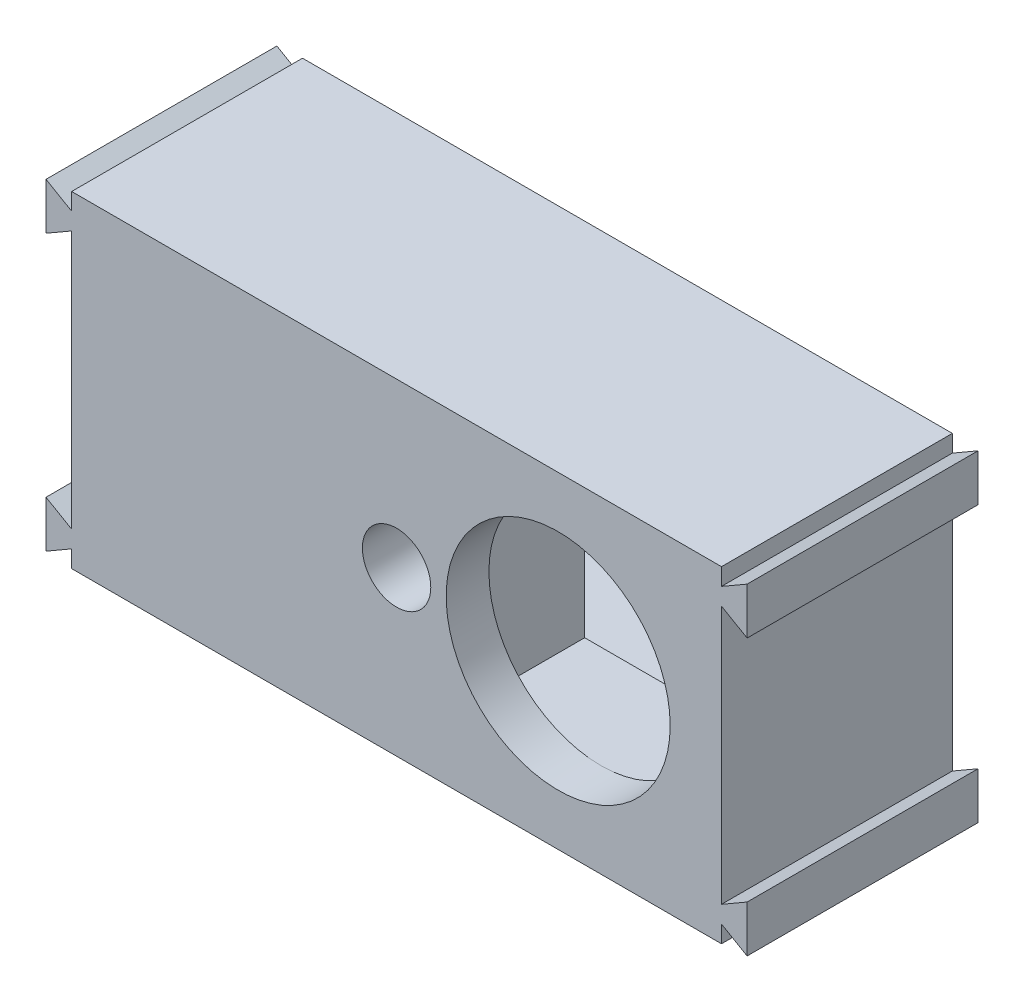
from build123d import *

# Parameters (mm, degrees)
SKETCH2_W           = 38
SKETCH2_H           = 19.1
SKETCH2_R           = 6.55
SKETCH2_R_2         = 2
BOSS_EXTRUDE1_DEPTH = 2.5
SKETCH3_R           = 2
SKETCH3_W           = 13.5
SKETCH3_H           = 13.1
BOSS_EXTRUDE2_DEPTH = 6
BOSS_EXTRUDE3_DEPTH = 5
BOSS_EXTRUDE4_DEPTH = 13.5


with BuildPart() as part:
    # Sketch2 → Boss-Extrude1 (new body)
    with BuildSketch(Plane.XY):
        Rectangle(SKETCH2_W, SKETCH2_H)
        with Locations((9.45, 0)):
            Circle(SKETCH2_R, mode=Mode.SUBTRACT)
        Circle(SKETCH2_R_2, mode=Mode.SUBTRACT)
    extrude(amount=-BOSS_EXTRUDE1_DEPTH)

    # Sketch3 → Boss-Extrude2 (add)
    with BuildSketch(Plane(origin=(0, 0, -2.5), x_dir=(-1, 0, 0), z_dir=(0, 0, -1))):
        Polygon((-19, -9.55), (19, -9.55), (19, -5.55), (2.5, -5.55), (2.5, 5.55), (19, 5.55), (19, 9.55), (-19, 9.55), align=None)
        with Locations(Location((0, 0, 0), (0, 0, 180))):
            Circle(SKETCH3_R, mode=Mode.SUBTRACT)
        with Locations((-9.25, 0)):
            Rectangle(SKETCH3_W, SKETCH3_H, mode=Mode.SUBTRACT)
    extrude(amount=BOSS_EXTRUDE2_DEPTH)

    # Sketch4 → Boss-Extrude3 (add)
    with BuildSketch(Plane(origin=(0, 0, -8.5), x_dir=(-1, 0, 0), z_dir=(0, 0, -1))):
        Polygon((19, 5.55), (16.5, 5.55), (16.5, 7.05), (-16.5, 7.05), (-16.5, -7.05), (16.5, -7.05), (16.5, -5.55), (19, -5.55), (19, -9.55), (-19, -9.55), (-19, 9.55), (19, 9.55), align=None)
    extrude(amount=BOSS_EXTRUDE3_DEPTH)

    # Sketch5 → Boss-Extrude4 (add)
    with BuildSketch(Plane(origin=(0, 0, -13.5), x_dir=(-1, 0, 0), z_dir=(0, 0, -1))):
        Polygon((-19, 8.55), (-20.5, 9.416025404), (-20.5, 6.683974596), (-19, 7.55), align=None)
        Polygon((-19, -7.55), (-19, -8.55), (-20.5, -9.416025404), (-20.5, -6.683974596), align=None)
    boss_extrude4 = extrude(amount=-BOSS_EXTRUDE4_DEPTH)

    # Mirror1: Boss-Extrude4 across plane
    add(boss_extrude4.mirror(Plane(origin=(0, 0, 0), x_dir=(0, 0, 1), z_dir=(1, 0, 0))))


solid = part.part
